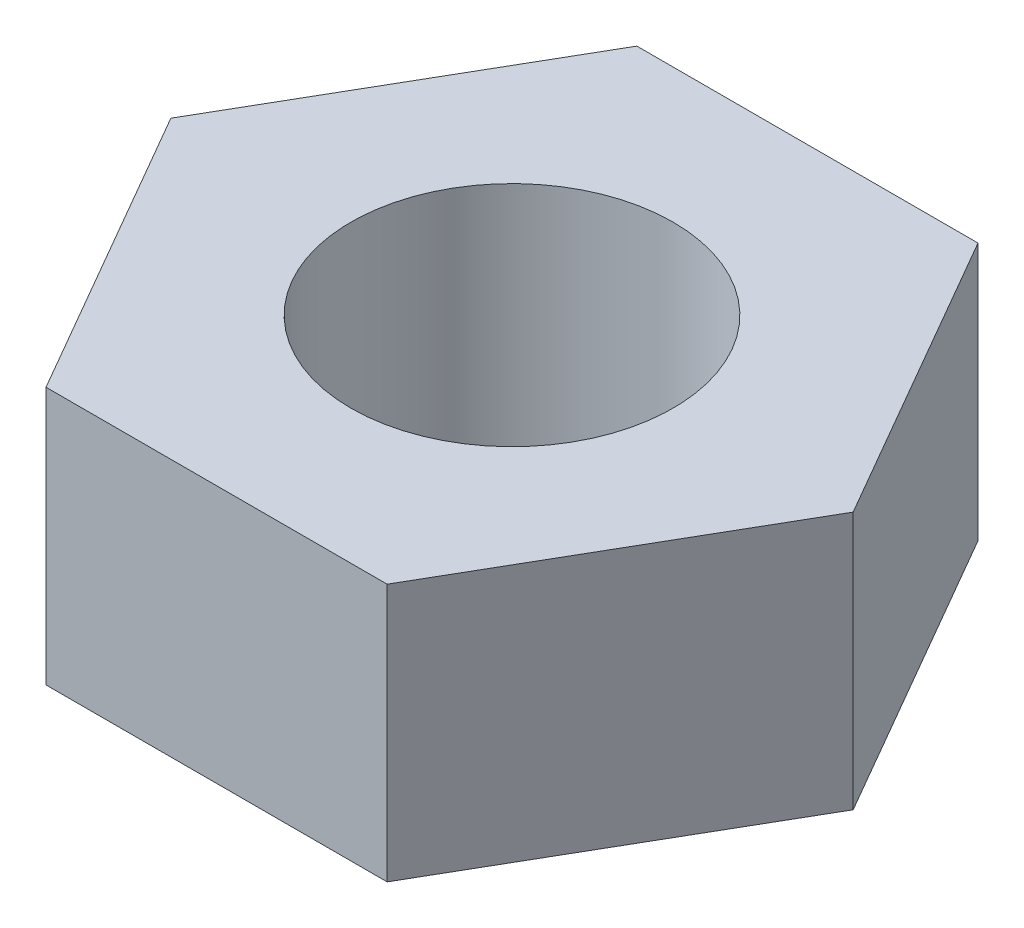
from build123d import *

# Parameters (mm, degrees)
SKETCH_1_R      = 1.5
EXTRUDE_1_DEPTH = 2.4


with BuildPart() as part:
    # 草图1 → 凸台-拉伸1 (new body)
    with BuildSketch(Plane(origin=(0, 0, 0), x_dir=(1, 0, 0), z_dir=(0, 1, 0))):
        Polygon((3.175426481, 0), (1.58771324, 2.75), (-1.58771324, 2.75), (-3.175426481, 0), (-1.58771324, -2.75), (1.58771324, -2.75), align=None)
        with Locations(Location((0, 0, 0), (0, 0, 270))):
            Circle(SKETCH_1_R, mode=Mode.SUBTRACT)
    extrude(amount=EXTRUDE_1_DEPTH)


solid = part.part
